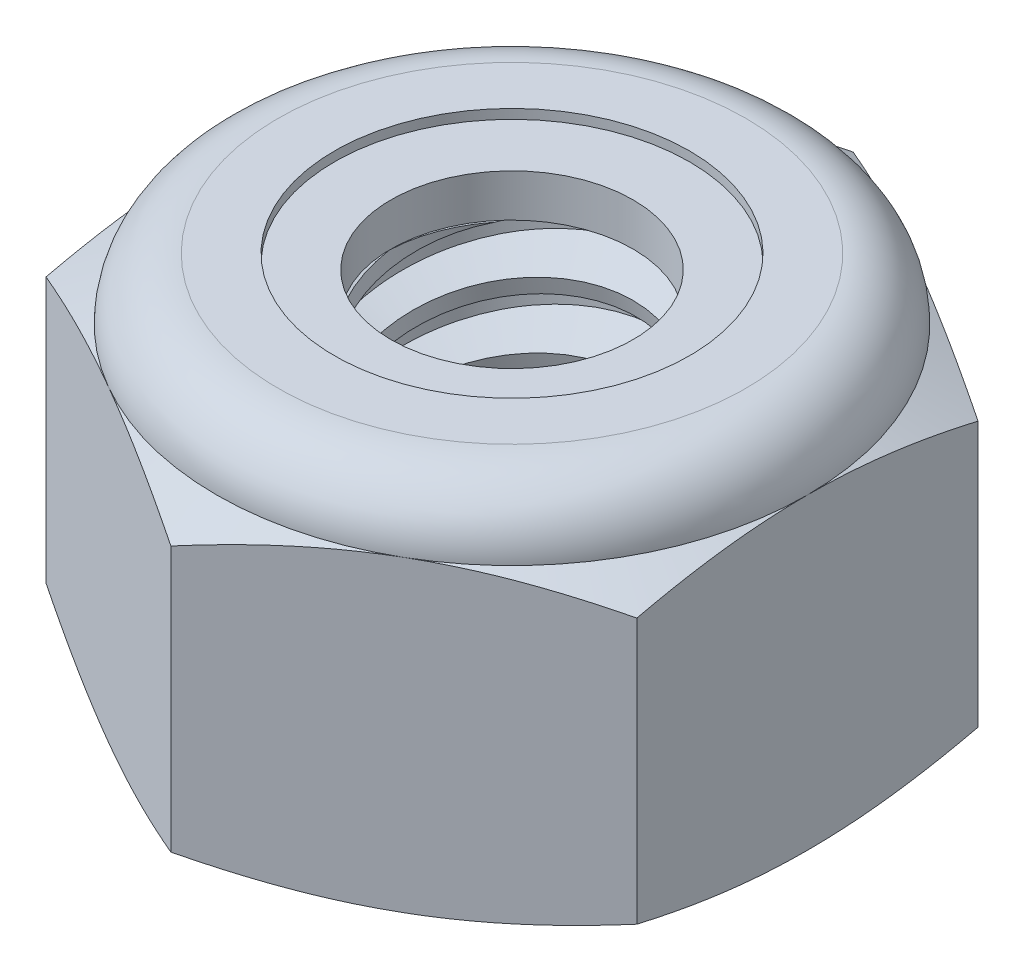
from build123d import *

# Parameters (mm, degrees)
EXTRUDE1_DEPTH       = 5.953125
SKETCH2_W            = 2.413
SKETCH2_H            = 5.953125
LPATTERN1_COUNT      = 6
LPATTERN1_PITCH      = 1.058333333
LPATTERN1_COUNT_DIR2 = 2
LPATTERN1_PITCH_DIR2 = 1.058333333


with BuildPart() as part:
    # Sketch1 → Extrude1 (new body)
    with BuildSketch(Plane(origin=(0, 0, 0), x_dir=(1, 0, 0), z_dir=(0, 1, 0))):
        Polygon((0, 5.499261314), (-4.7625, 2.749630657), (-4.7625, -2.749630657), (0, -5.499261314), (4.7625, -2.749630657), (4.7625, 2.749630657), align=None)
    extrude(amount=EXTRUDE1_DEPTH)

    # Sketch4 → Cut-Revolve2 (revolve, cut)
    with BuildSketch(Plane(origin=(0, 0, 0), x_dir=(0, 0, -1), z_dir=(1, 0, 0))):
        Polygon((0, 5.953125), (2.413, 5.953125), (1.952639712, 5.738455472), (1.952639712, 0.214669528), (2.413, 0), (0, 0), align=None)
    revolve(axis=Axis((0, 5.953125, 0), (0, 1, 0)), mode=Mode.SUBTRACT)


with BuildPart() as body_2:
    # Sketch2 → Revolve1 (revolve)
    with BuildSketch(Plane(origin=(0, 0, 0), x_dir=(0, 0, -1), z_dir=(1, 0, 0))):
        with Locations((1.2065, 2.9765625)):
            Rectangle(SKETCH2_W, SKETCH2_H)
    revolve(axis=Axis((0, -2.413, 0), (0, 1, 0)))

    # Sketch3 → Cut-Revolve1 (revolve, cut)
    with BuildSketch(Plane(origin=(0, 0, 0), x_dir=(0, 0, -1), z_dir=(1, 0, 0))):
        Polygon((2.441337922, 5.823904076), (2.639703376, 4.919357607), (2.009315556, 5.119703115), (1.952639712, 5.378144964), align=None)
    cut_revolve1 = revolve(axis=Axis((0, 5.953125, 0.249698658), (0, -0.976788088344826, -0.21420791411070786)), mode=Mode.SUBTRACT)

    # LPattern1: Cut-Revolve1 6 × 2
    with Locations(*[Vector(0, -1, 0) * (i * LPATTERN1_PITCH) + Vector(0, 1, 0) * (j * LPATTERN1_PITCH_DIR2) for i in range(LPATTERN1_COUNT) for j in range(LPATTERN1_COUNT_DIR2) if (i, j) != (0, 0)]):
        add(cut_revolve1, mode=Mode.SUBTRACT)


with BuildPart() as part_1:
    add(part.part)

    # Combine1: cut body 2
    add(body_2.part, mode=Mode.SUBTRACT)

    # Sketch5 → Cut-Revolve3 (revolve, cut)
    with BuildSketch(Plane(origin=(0, 0, 0), x_dir=(0, 0, -1), z_dir=(1, 0, 0))):
        with BuildLine():
            Line((0, 0), (4.7625, 0))
            Line((4.7625, 0), (5.499261314, 0.343557443))
            Line((5.499261314, 0.343557443), (5.499261314, 4.617380057))
            Line((5.499261314, 4.617380057), (4.7625, 4.9609375))
            ThreePointArc((4.7625, 4.9609375), (4.471895009, 5.662520009), (3.7703125, 5.953125))
            Line((3.7703125, 5.953125), (3.7703125, 7.223125))
            Line((3.7703125, 7.223125), (6.769261314, 7.223125))
            Line((6.769261314, 7.223125), (6.769261314, -1.27))
            Line((6.769261314, -1.27), (0, -1.27))
            Line((0, -1.27), (0, 0))
        make_face()
    revolve(axis=Axis((0, 0, 0), (0, 1, 0)), mode=Mode.SUBTRACT)

    # Sketch6 → Cut-Revolve4 (revolve, cut)
    with BuildSketch(Plane(origin=(0, 0, 0), x_dir=(0, 0, -1), z_dir=(1, 0, 0))):
        with BuildLine():
            Line((0, 4.9609375), (4.6101, 4.9609375))
            ThreePointArc((4.6101, 4.9609375), (4.364131936, 5.554756936), (3.7703125, 5.800725))
            Line((3.7703125, 5.800725), (2.861476106, 5.800725))
            Line((2.861476106, 5.800725), (2.861476106, 7.223125))
            Line((2.861476106, 7.223125), (0, 7.223125))
            Line((0, 7.223125), (0, 4.9609375))
        make_face()
    revolve(axis=Axis((0, 7.223125, 0), (0, 1, 0)), mode=Mode.SUBTRACT)


with BuildPart() as body_2_2:
    # Sketch7 → Revolve2 (revolve)
    with BuildSketch(Plane(origin=(0, 0, 0), x_dir=(0, 0, -1), z_dir=(1, 0, 0))):
        with BuildLine():
            Line((1.952639712, 5.0371375), (4.530088408, 5.0371375))
            ThreePointArc((4.530088408, 5.0371375), (4.282601726, 5.527175629), (3.7703125, 5.724525))
            Line((3.7703125, 5.724525), (1.952639712, 5.724525))
            Line((1.952639712, 5.724525), (1.952639712, 5.0371375))
        make_face()
    revolve(axis=Axis((0, 5.0371375, 0), (0, 1, 0)))


solid = Compound([part_1.part, body_2_2.part])
